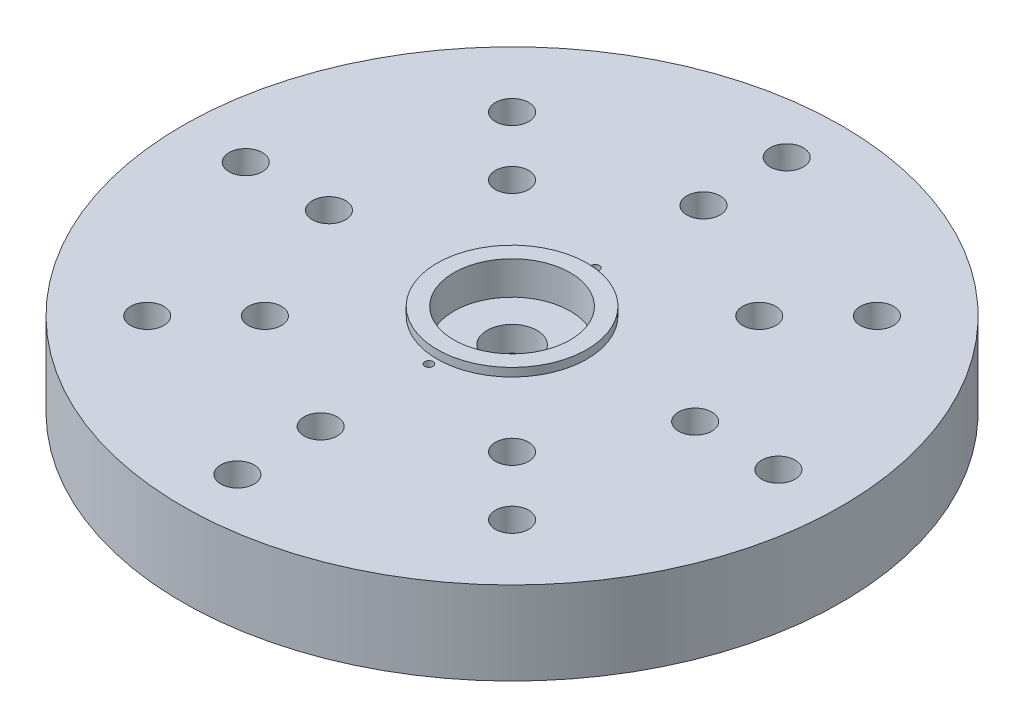
from build123d import *

# Parameters (mm, degrees)
ESQUISSE2_R                  = 1
ESQUISSE2_R_2                = 0.25
ENL_V_MAT_EXTRU_1_DEPTH      = 10
R_P_TITION_CIRCULAIRE1_COUNT = 2


with BuildPart() as part:
    # Esquisse1 → Révolution1 (revolve)
    with BuildSketch(Plane.XY, mode=Mode.PRIVATE) as r_volution1_sk:
        Polygon((4, 0), (4, 5), (1.5, 5), (1.5, 6.5), (3.5, 6.5), (3.5, 8.5), (4.5, 8.5), (4.5, 8), (19.8, 8), (19.8, 3), (6, 3), (6, 0), align=None)
    revolve(r_volution1_sk.sketch.rotate(Axis((0, 0, 0), (0, 1, 0)), 90), axis=Axis((0, 0, 0), (0, 1, 0)))

    # Esquisse2 → Enlèv. mat.-Extru.1 (cut)
    with BuildSketch(Plane(origin=(0, 8, 0), x_dir=(1, 0, 0), z_dir=(0, 1, 0))):
        with Locations(Location((0, 16.5, 0), (0, 0, 270))):
            Circle(ESQUISSE2_R)
        with Locations(Location((0, 11.5, 0), (0, 0, 270))):
            Circle(ESQUISSE2_R)
        with Locations(Location((0, 5, 0), (0, 0, 270))):
            Circle(ESQUISSE2_R_2)
        with Locations(Location((7.424621202, 7.424621202, 0), (0, 0, 270))):
            Circle(ESQUISSE2_R)
        with Locations(Location((10.960155108, 10.960155108, 0), (0, 0, 270))):
            Circle(ESQUISSE2_R)
        with Locations(Location((11, 0, 0), (0, 0, 270))):
            Circle(ESQUISSE2_R)
        with Locations(Location((16, 0, 0), (0, 0, 270))):
            Circle(ESQUISSE2_R)
        with Locations(Location((10.606601718, -10.606601718, 0), (0, 0, 270))):
            Circle(ESQUISSE2_R)
        with Locations(Location((7.071067812, -7.071067812, 0), (0, 0, 270))):
            Circle(ESQUISSE2_R)
    enl_v_mat_extru_1 = extrude(amount=-ENL_V_MAT_EXTRU_1_DEPTH, mode=Mode.SUBTRACT)

    # Répétition circulaire1: Enlèv. mat.-Extru.1 ×2 about axis
    r_p_tition_circulaire1_axis = Axis((0, 0, 0), (0, 1, 0))
    for i in range(1, R_P_TITION_CIRCULAIRE1_COUNT):
        add(enl_v_mat_extru_1.rotate(r_p_tition_circulaire1_axis, i * 360 / R_P_TITION_CIRCULAIRE1_COUNT), mode=Mode.SUBTRACT)


solid = part.part
